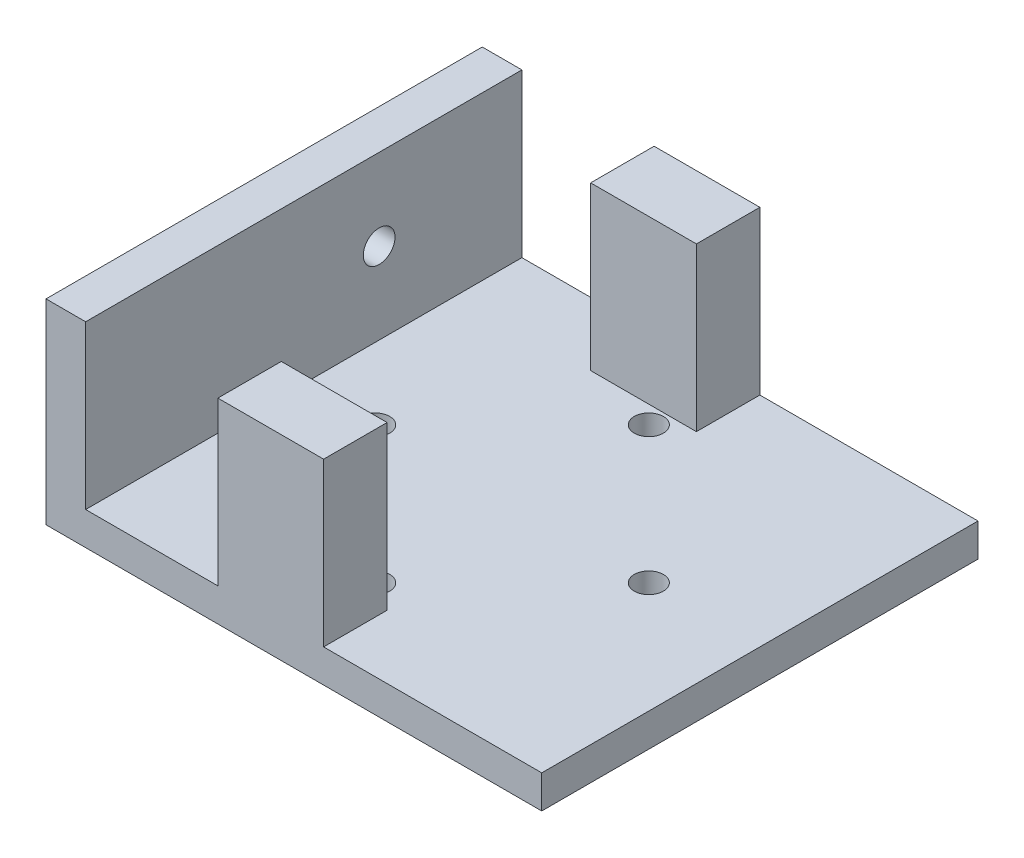
from build123d import *

# Parameters (mm, degrees)
SKIZZE1_W                       = 37.5
SKIZZE1_H                       = 33
AUFSATZ_LINEAR_AUSTRAGEN1_DEPTH = 2.5
SKIZZE2_W                       = 3
SKIZZE2_H                       = 33
SKIZZE2_W_2                     = 8
SKIZZE2_H_2                     = 4.8
AUFSATZ_LINEAR_AUSTRAGEN2_DEPTH = 12.3
SCHNITT_LINEAR_AUSTRAGEN3_DEPTH = 30.031922086
SKIZZE5_R                       = 1.2
SCHNITT_LINEAR_AUSTRAGEN4_DEPTH = 42.006584837


with BuildPart() as part:
    # Skizze1 → Aufsatz-Linear austragen1 (new body)
    with BuildSketch(Plane(origin=(0, 0, 0), x_dir=(1, 0, 0), z_dir=(0, 1, 0))):
        Rectangle(SKIZZE1_W, SKIZZE1_H)
    extrude(amount=AUFSATZ_LINEAR_AUSTRAGEN1_DEPTH)

    # Skizze2 → Aufsatz-Linear austragen2 (add)
    with BuildSketch(Plane(origin=(0, 2.5, 0), x_dir=(1, 0, 0), z_dir=(0, 1, 0))):
        with Locations((-17.25, 0)):
            Rectangle(SKIZZE2_W, SKIZZE2_H)
        with Locations((-1.75, -14.1)):
            Rectangle(SKIZZE2_W_2, SKIZZE2_H_2)
        with Locations((-1.75, 14.1)):
            Rectangle(SKIZZE2_W_2, SKIZZE2_H_2)
    extrude(amount=AUFSATZ_LINEAR_AUSTRAGEN2_DEPTH)

    # Skizze6 → Schnitt-Linear austragen3 (cut, through all)
    with BuildSketch(Plane.XZ):
        with BuildLine():
            ThreePointArc((-10.291545894, -1.098445774), (-9.551783389, -0.756868708), (-9.25, 0))
            ThreePointArc((-9.25, 0), (-9.551783389, 0.756868708), (-10.291545894, 1.098445774))
            ThreePointArc((-10.291545894, 1.098445774), (-10.35, 0), (-10.291545894, -1.098445774))
        make_face()
        with BuildLine():
            ThreePointArc((-10.291545894, -1.098445774), (-10.35, 0), (-10.291545894, 1.098445774))
            ThreePointArc((-10.291545894, 1.098445774), (-11.45, 0), (-10.291545894, -1.098445774))
        make_face()
        with BuildLine():
            ThreePointArc((-1.098445774, 10.291545894), (0, 9.25), (1.098445774, 10.291545894))
            ThreePointArc((1.098445774, 10.291545894), (0, 10.35), (-1.098445774, 10.291545894))
        make_face()
        with BuildLine():
            ThreePointArc((-1.098445774, 10.291545894), (0, 10.35), (1.098445774, 10.291545894))
            ThreePointArc((1.098445774, 10.291545894), (1.099611375, 10.320762617), (1.1, 10.35))
            ThreePointArc((1.1, 10.35), (-0.029237383, 11.449611375), (-1.098445774, 10.291545894))
        make_face()
        with BuildLine():
            ThreePointArc((10.291545894, -1.098445774), (11.106868708, -0.798216611), (11.45, 0))
            ThreePointArc((11.45, 0), (11.106868708, 0.798216611), (10.291545894, 1.098445774))
            ThreePointArc((10.291545894, 1.098445774), (10.35, 0), (10.291545894, -1.098445774))
        make_face()
        with BuildLine():
            ThreePointArc((10.291545894, -1.098445774), (10.35, 0), (10.291545894, 1.098445774))
            ThreePointArc((10.291545894, 1.098445774), (9.25, 0), (10.291545894, -1.098445774))
        make_face()
        with BuildLine():
            ThreePointArc((-1.098445774, -10.291545894), (-0.029237383, -11.449611375), (1.1, -10.35))
            ThreePointArc((1.1, -10.35), (1.099611375, -10.320762617), (1.098445774, -10.291545894))
            ThreePointArc((1.098445774, -10.291545894), (0, -10.35), (-1.098445774, -10.291545894))
        make_face()
        with BuildLine():
            ThreePointArc((-1.098445774, -10.291545894), (0, -10.35), (1.098445774, -10.291545894))
            ThreePointArc((1.098445774, -10.291545894), (0, -9.25), (-1.098445774, -10.291545894))
        make_face()
    extrude(amount=-SCHNITT_LINEAR_AUSTRAGEN3_DEPTH, mode=Mode.SUBTRACT)

    # Skizze5 → Schnitt-Linear austragen4 (cut, through all)
    with BuildSketch(Plane(origin=(-15.75, 0, 0), x_dir=(0, 0, -1), z_dir=(1, 0, 0))):
        with Locations((5.7, 8.65)):
            Circle(SKIZZE5_R)
    extrude(amount=-SCHNITT_LINEAR_AUSTRAGEN4_DEPTH, mode=Mode.SUBTRACT)


solid = part.part
